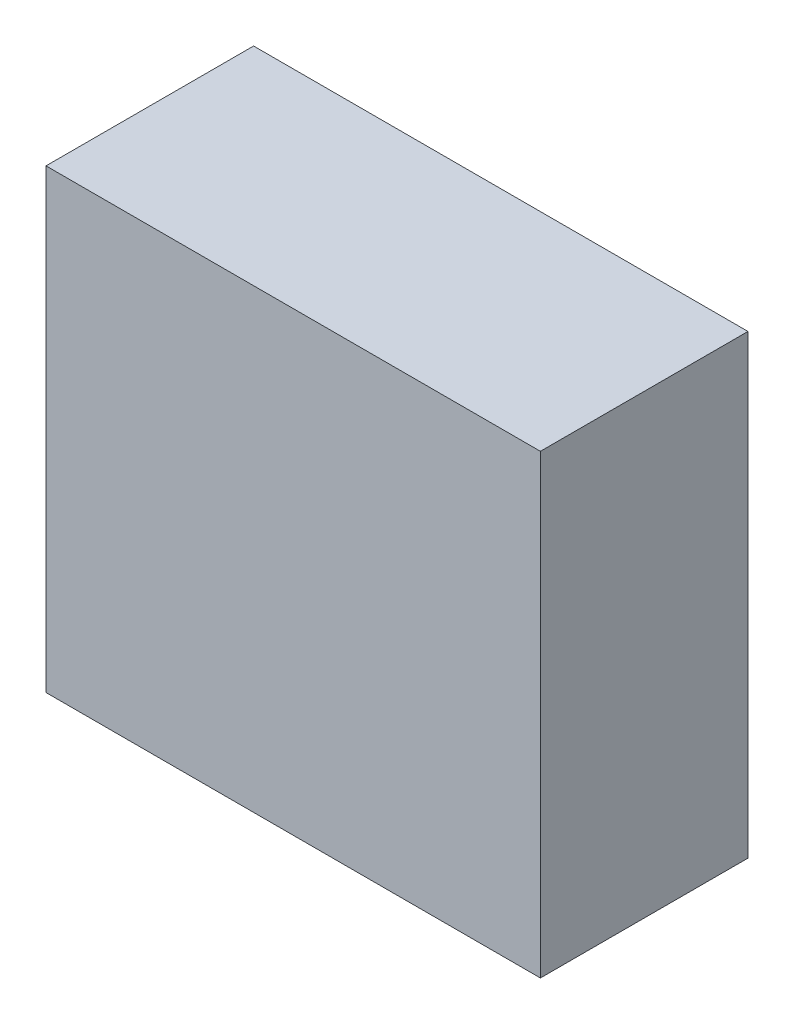
from build123d import *

# Parameters (mm, degrees)
SKETCH1_W           = 181
SKETCH1_H           = 76
BOSS_EXTRUDE1_DEPTH = 167


with BuildPart() as part:
    # Sketch1 → Boss-Extrude1 (new body)
    with BuildSketch(Plane(origin=(0, 0, 0), x_dir=(1, 0, 0), z_dir=(0, 1, 0))):
        Rectangle(SKETCH1_W, SKETCH1_H)
    extrude(amount=BOSS_EXTRUDE1_DEPTH)


solid = part.part
